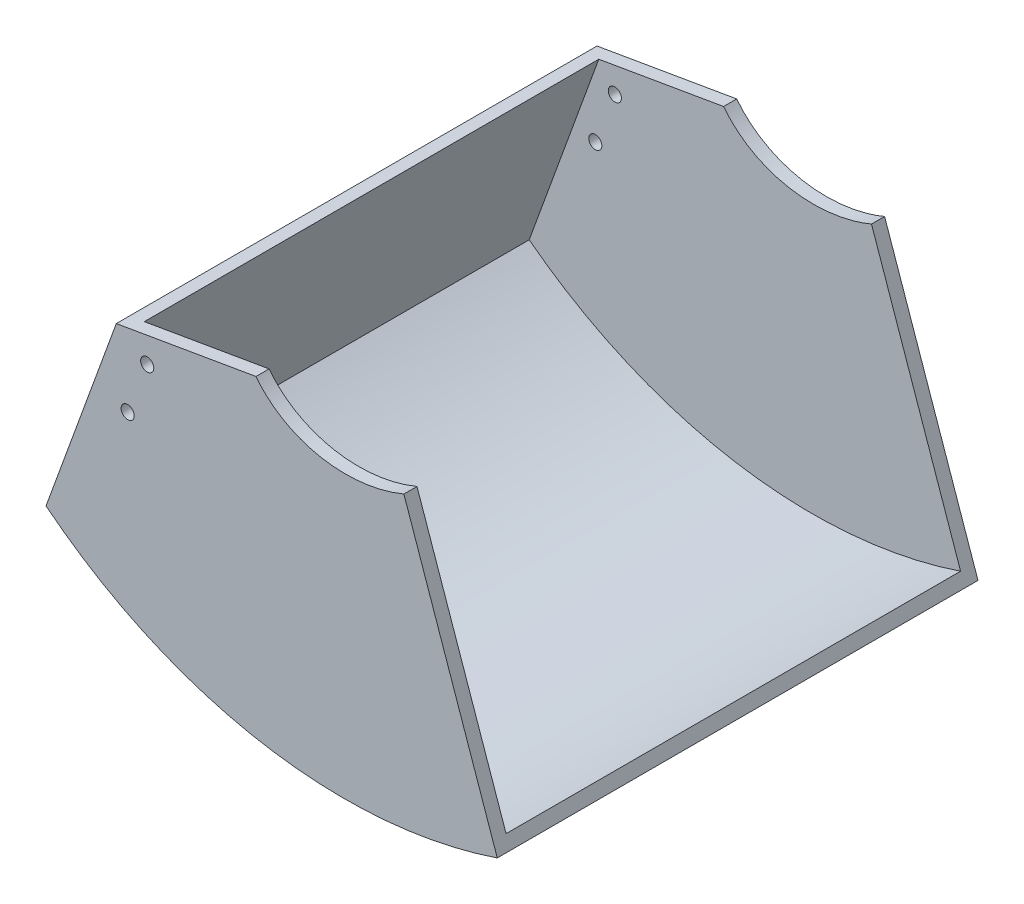
from build123d import *

# Parameters (mm, degrees)
EXTRUDE_1_DEPTH           = 3
EXTRUDE_2_DEPTH           = 104
EXTRUDE_3_DEPTH           = 3
CUT_EXTRUDE_1_DEPTH       = 159.483205287
HOLE_WIZARD_3_0_3_1_D     = 3
HOLE_WIZARD_3_0_3_1_DEPTH = 3
HOLE_WIZARD_3_0_3_2_D     = 3
HOLE_WIZARD_3_0_3_2_DEPTH = 110


with BuildPart() as part:
    # 草图1 → 凸台-拉伸1 (new body)
    with BuildSketch(Plane.XY.offset(110)):
        with BuildLine():
            Line((48.043658488, 49.686561818), (16.083624337, 44.189394688))
            Line((16.083624337, 44.189394688), (0, 0))
            ThreePointArc((0, 0), (49.31823123, -22.233763367), (103.260442774, -18.126942356))
            Line((103.260442774, -18.126942356), (81.890470472, 43.311728011))
            add(Edge.make_bspline(
                [(48.043658488, 49.686561818), (60.031404168, 34.166493651), (81.890470472, 43.311728011)],
                knots=[3.390052137, 3.390052137, 3.390052137, 4.76191312, 4.76191312, 4.76191312], degree=2, weights=[1, 0.773830015, 1]))
        make_face()
    extrude(amount=-EXTRUDE_1_DEPTH)

    # 草图2 → 凸台-拉伸2 (add)
    with BuildSketch(Plane(origin=(0, 0, 107), x_dir=(-1, 0, 0), z_dir=(0, 0, -1))):
        with BuildLine():
            Line((-3.564517285, 1.022017551), (-19.489368658, 44.775187108))
            Line((-19.489368658, 44.775187108), (-16.083624337, 44.189394688))
            Line((-16.083624337, 44.189394688), (0, 0))
            ThreePointArc((0, 0), (-49.31823123, -22.233763367), (-103.260442774, -18.126942356))
            Line((-103.260442774, -18.126942356), (-102.274839972, -15.293334302))
            ThreePointArc((-102.274839972, -15.293334302), (-50.883106444, -19.457225166), (-3.564517285, 1.022017551))
        make_face()
    extrude(amount=EXTRUDE_2_DEPTH)

    # 草图3 → 凸台-拉伸3 (add)
    with BuildSketch(Plane(origin=(0, 0, 3), x_dir=(-1, 0, 0), z_dir=(0, 0, -1))):
        with BuildLine():
            Line((-77.887672968, 54.819770834), (-16.083624337, 44.189394688))
            Line((-16.083624337, 44.189394688), (0, 0))
            ThreePointArc((0, 0), (-49.31823123, -22.233763367), (-103.260442774, -18.126942356))
            Line((-103.260442774, -18.126942356), (-77.887672968, 54.819770834))
        make_face()
    extrude(amount=EXTRUDE_3_DEPTH)

    # 草图4 → 切除-拉伸1 (cut, through all)
    with BuildSketch(Plane.XY.offset(3)):
        with BuildLine():
            Line((77.887672968, 54.819770834), (48.043658488, 49.686561818))
            add(Edge.make_bspline(
                [(48.043658488, 49.686561818), (60.032354081, 34.167172902), (81.890470472, 43.311728011)],
                knots=[3.389784889, 3.389784889, 3.389784889, 4.7613973, 4.7613973, 4.7613973], degree=2, weights=[1, 0.773908731, 1]))
            Line((81.890470472, 43.311728011), (77.887672968, 54.819770834))
        make_face()
    extrude(amount=-CUT_EXTRUDE_1_DEPTH, mode=Mode.SUBTRACT)

    # Ø3.0 (3) 直径孔1
    with Locations(Plane(origin=(0, 0, 107), x_dir=(-1, 0, 0), z_dir=(0, 0, -1))):
        with Locations((-18.688258909, 27.955134161), (-23.158328606, 39.628543128)):
            Hole(HOLE_WIZARD_3_0_3_1_D / 2, depth=HOLE_WIZARD_3_0_3_1_DEPTH)

    # Ø3.0 (3) 直径孔2
    with Locations(Plane(origin=(0, 0, 0), x_dir=(-1, 0, 0), z_dir=(0, 0, -1))):
        with Locations((-18.688258909, 27.955134161), (-23.158328606, 39.628543128)):
            Hole(HOLE_WIZARD_3_0_3_2_D / 2, depth=HOLE_WIZARD_3_0_3_2_DEPTH)


solid = part.part
